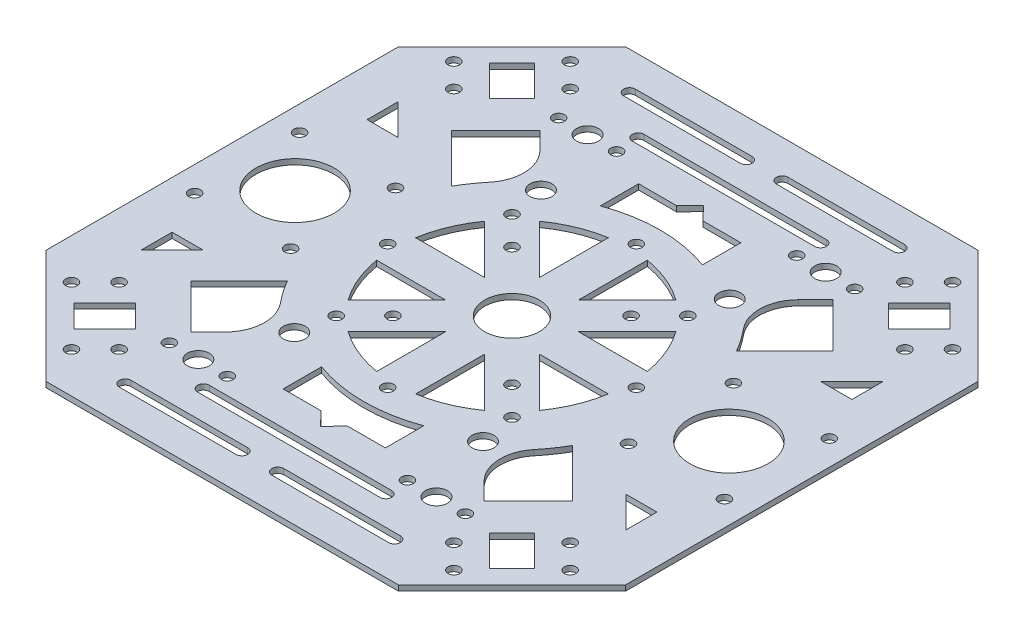
from build123d import *

# Parameters (mm, degrees)
BOSS_EXTRUDE1_DEPTH = 0.7
SKETCH3_R           = 1.5
CUT_EXTRUDE1_DEPTH  = 105.661167584
SKETCH9_R           = 1.5
SKETCH9_R_2         = 2.8
CUT_EXTRUDE5_DEPTH  = 105.661167584
SKETCH10_R          = 10
SKETCH10_R_2        = 1.5
CUT_EXTRUDE6_DEPTH  = 105.661167584
SKETCH11_R          = 7
SKETCH11_R_2        = 1.5
CUT_EXTRUDE7_DEPTH  = 105.661167584


with BuildPart() as part:
    # Sketch1 → Boss-Extrude1 (new, symmetric)
    with BuildSketch(Plane(origin=(0, 0, 0), x_dir=(1, 0, 0), z_dir=(0, 1, 0))):
        Polygon((-74, 45), (-45, 74), (45, 74), (74, 45), (74, -45), (45, -74), (-45, -74), (-74, -45), align=None)
    extrude(amount=BOSS_EXTRUDE1_DEPTH, both=True)

    # Sketch3 → Cut-Extrude1 (cut, through all)
    with BuildSketch(Plane(origin=(0, 0.7, 0), x_dir=(1, 0, 0), z_dir=(0, 1, 0))):
        with Locations(Location((-48.822687604, 63.671930009, 0), (0, 0, 270))):
            Circle(SKETCH3_R)
        with Locations(Location((-63.671930009, 48.822687604, 0), (0, 0, 270))):
            Circle(SKETCH3_R)
        with Locations(Location((-57.590811691, 42.741569286, 0), (0, 0, 270))):
            Circle(SKETCH3_R)
        with Locations(Location((-42.741569286, 57.590811691, 0), (0, 0, 270))):
            Circle(SKETCH3_R)
        with Locations(Location((63.671930009, 48.822687604, 0), (0, 0, 270))):
            Circle(SKETCH3_R)
        with Locations(Location((48.822687604, 63.671930009, 0), (0, 0, 270))):
            Circle(SKETCH3_R)
        with Locations(Location((42.741569286, 57.590811691, 0), (0, 0, 270))):
            Circle(SKETCH3_R)
        with Locations(Location((57.590811691, 42.741569286, 0), (0, 0, 270))):
            Circle(SKETCH3_R)
        with Locations(Location((48.822687604, -63.671930009, 0), (0, 0, 270))):
            Circle(SKETCH3_R)
        with Locations(Location((63.671930009, -48.822687604, 0), (0, 0, 270))):
            Circle(SKETCH3_R)
        with Locations(Location((57.590811691, -42.741569286, 0), (0, 0, 270))):
            Circle(SKETCH3_R)
        with Locations(Location((42.741569286, -57.590811691, 0), (0, 0, 270))):
            Circle(SKETCH3_R)
        with Locations(Location((-63.671930009, -48.822687604, 0), (0, 0, 270))):
            Circle(SKETCH3_R)
        with Locations(Location((-48.822687604, -63.671930009, 0), (0, 0, 270))):
            Circle(SKETCH3_R)
        with Locations(Location((-42.741569286, -57.590811691, 0), (0, 0, 270))):
            Circle(SKETCH3_R)
        with Locations(Location((-57.590811691, -42.741569286, 0), (0, 0, 270))):
            Circle(SKETCH3_R)
        Polygon((-50.908652609, 45.181087681), (-58.75753788, 53.029972952), (-53.029972952, 58.75753788), (-45.181087681, 50.908652609), align=None)
        Polygon((45.181087681, 50.908652609), (53.029972952, 58.75753788), (58.75753788, 53.029972952), (50.908652609, 45.181087681), align=None)
        Polygon((50.908652609, -45.181087681), (58.75753788, -53.029972952), (53.029972952, -58.75753788), (45.181087681, -50.908652609), align=None)
        Polygon((-45.181087681, -50.908652609), (-53.029972952, -58.75753788), (-58.75753788, -53.029972952), (-50.908652609, -45.181087681), align=None)
    extrude(amount=-CUT_EXTRUDE1_DEPTH, mode=Mode.SUBTRACT)

    # Sketch9 → Cut-Extrude5 (cut, through all)
    with BuildSketch(Plane(origin=(0, 0.7, 0), x_dir=(1, 0, 0), z_dir=(0, 1, 0))):
        with Locations(Location((-37.8, 49.7, 0), (0, 0, 270))):
            Circle(SKETCH9_R)
        with Locations(Location((-30.4, 49.7, 0), (0, 0, 270))):
            Circle(SKETCH9_R_2)
        with Locations(Location((-23, 49.7, 0), (0, 0, 270))):
            Circle(SKETCH9_R)
        with Locations(Location((23, 49.7, 0), (0, 0, 270))):
            Circle(SKETCH9_R)
        with Locations(Location((30.4, 49.7, 0), (0, 0, 270))):
            Circle(SKETCH9_R_2)
        with Locations(Location((37.8, 49.7, 0), (0, 0, 270))):
            Circle(SKETCH9_R)
        with Locations(Location((-24.1, 31.5, 0), (0, 0, 270))):
            Circle(SKETCH9_R_2)
        with Locations(Location((24.1, 31.5, 0), (0, 0, 270))):
            Circle(SKETCH9_R_2)
        with Locations(Location((24.1, -31.5, 0), (0, 0, 90))):
            Circle(SKETCH9_R_2)
        with Locations(Location((-24.1, -31.5, 0), (0, 0, 90))):
            Circle(SKETCH9_R_2)
        with Locations(Location((37.8, -49.7, 0), (0, 0, 90))):
            Circle(SKETCH9_R)
        with Locations(Location((30.4, -49.7, 0), (0, 0, 90))):
            Circle(SKETCH9_R_2)
        with Locations(Location((23, -49.7, 0), (0, 0, 90))):
            Circle(SKETCH9_R)
        with Locations(Location((-23, -49.7, 0), (0, 0, 90))):
            Circle(SKETCH9_R)
        with Locations(Location((-30.4, -49.7, 0), (0, 0, 90))):
            Circle(SKETCH9_R_2)
        with Locations(Location((-37.8, -49.7, 0), (0, 0, 90))):
            Circle(SKETCH9_R)
        with BuildLine():
            Line((-34.4, 65.9), (-4.6, 65.9))
            ThreePointArc((-4.6, 65.9), (-3.1, 64.4), (-4.6, 62.9))
            Line((-4.6, 62.9), (-34.4, 62.9))
            ThreePointArc((-34.4, 62.9), (-35.9, 64.4), (-34.4, 65.9))
        make_face()
        with BuildLine():
            Line((4.6, 65.9), (34.4, 65.9))
            ThreePointArc((34.4, 65.9), (35.9, 64.4), (34.4, 62.9))
            Line((34.4, 62.9), (4.6, 62.9))
            ThreePointArc((4.6, 62.9), (3.1, 64.4), (4.6, 65.9))
        make_face()
        with BuildLine():
            Line((-23.3, 57), (23.3, 57))
            ThreePointArc((23.3, 57), (24.8, 55.5), (23.3, 54))
            Line((23.3, 54), (-23.3, 54))
            ThreePointArc((-23.3, 54), (-24.8, 55.5), (-23.3, 57))
        make_face()
        with BuildLine():
            Line((-3.4, 45.382404359), (0, 48.882404359))
            Line((0, 48.882404359), (3.4, 45.382404359))
            Line((3.4, 45.382404359), (13.05, 45.382404359))
            Line((13.05, 45.382404359), (13.05, 35.582404359))
            ThreePointArc((13.05, 35.582404359), (0, 37.9), (-13.05, 35.582404359))
            Line((-13.05, 35.582404359), (-13.05, 45.382404359))
            Line((-13.05, 45.382404359), (-3.4, 45.382404359))
        make_face()
        with BuildLine():
            Line((-34.4, -65.9), (-4.6, -65.9))
            ThreePointArc((-4.6, -65.9), (-3.1, -64.4), (-4.6, -62.9))
            Line((-4.6, -62.9), (-34.4, -62.9))
            ThreePointArc((-34.4, -62.9), (-35.9, -64.4), (-34.4, -65.9))
        make_face()
        with BuildLine():
            Line((4.6, -65.9), (34.4, -65.9))
            ThreePointArc((34.4, -65.9), (35.9, -64.4), (34.4, -62.9))
            Line((34.4, -62.9), (4.6, -62.9))
            ThreePointArc((4.6, -62.9), (3.1, -64.4), (4.6, -65.9))
        make_face()
        with BuildLine():
            Line((-23.3, -57), (23.3, -57))
            ThreePointArc((23.3, -57), (24.8, -55.5), (23.3, -54))
            Line((23.3, -54), (-23.3, -54))
            ThreePointArc((-23.3, -54), (-24.8, -55.5), (-23.3, -57))
        make_face()
        with BuildLine():
            Line((3.4, -45.382404359), (13.05, -45.382404359))
            Line((13.05, -45.382404359), (13.05, -35.582404359))
            ThreePointArc((13.05, -35.582404359), (0, -37.9), (-13.05, -35.582404359))
            Line((-13.05, -35.582404359), (-13.05, -45.382404359))
            Line((-13.05, -45.382404359), (-3.4, -45.382404359))
            Line((-3.4, -45.382404359), (0, -48.882404359))
            Line((0, -48.882404359), (3.4, -45.382404359))
        make_face()
    extrude(amount=-CUT_EXTRUDE5_DEPTH, mode=Mode.SUBTRACT)

    # Sketch10 → Cut-Extrude6 (cut, through all)
    with BuildSketch(Plane(origin=(0, 0.7, 0), x_dir=(1, 0, 0), z_dir=(0, 1, 0))):
        with Locations(Location((-55.4, 0, 0), (0, 0, 270))):
            Circle(SKETCH10_R)
        with Locations(Location((-67.65, 13.4, 0), (0, 0, 270))):
            Circle(SKETCH10_R_2)
        with Locations(Location((-43.15, 13.4, 0), (0, 0, 270))):
            Circle(SKETCH10_R_2)
        with Locations(Location((-43.15, -13.4, 0), (0, 0, 270))):
            Circle(SKETCH10_R_2)
        with Locations(Location((-67.65, -13.4, 0), (0, 0, 270))):
            Circle(SKETCH10_R_2)
        with Locations(Location((67.65, -13.4, 0), (0, 0, 90))):
            Circle(SKETCH10_R_2)
        with Locations(Location((43.15, -13.4, 0), (0, 0, 90))):
            Circle(SKETCH10_R_2)
        with Locations(Location((43.15, 13.4, 0), (0, 0, 90))):
            Circle(SKETCH10_R_2)
        with Locations(Location((67.65, 13.4, 0), (0, 0, 90))):
            Circle(SKETCH10_R_2)
        with Locations(Location((55.4, 0, 0), (0, 0, 90))):
            Circle(SKETCH10_R)
        Polygon((-61.9, 32.8), (-61.9, 24.9), (-54, 24.9), align=None)
        Polygon((-61.9, -24.9), (-61.9, -32.8), (-54, -24.9), align=None)
        with BuildLine():
            Line((-48.716621587, 33.230983079), (-36.414211791, 20.928573283))
            ThreePointArc((-36.414211791, 20.928573283), (-34.52479878, 23.917321531), (-32.390688369, 26.736553761))
            ThreePointArc((-32.390688369, 26.736553761), (-30.114116226, 33.578902702), (-33.031689216, 40.173467706))
            Line((-33.031689216, 40.173467706), (-37.402913088, 44.544691578))
            Line((-37.402913088, 44.544691578), (-48.716621587, 33.230983079))
        make_face()
        with BuildLine():
            Line((-37.402913088, -44.544691578), (-33.031689216, -40.173467706))
            ThreePointArc((-33.031689216, -40.173467706), (-30.114116226, -33.578902702), (-32.390688369, -26.736553761))
            ThreePointArc((-32.390688369, -26.736553761), (-34.52479878, -23.917321531), (-36.414211791, -20.928573283))
            Line((-36.414211791, -20.928573283), (-48.716621587, -33.230983079))
            Line((-48.716621587, -33.230983079), (-37.402913088, -44.544691578))
        make_face()
        with BuildLine():
            Line((48.716621587, -33.230983079), (36.414211791, -20.928573283))
            ThreePointArc((36.414211791, -20.928573283), (34.52479878, -23.917321531), (32.390688369, -26.736553761))
            ThreePointArc((32.390688369, -26.736553761), (30.114116226, -33.578902702), (33.031689216, -40.173467706))
            Line((33.031689216, -40.173467706), (37.402913088, -44.544691578))
            Line((37.402913088, -44.544691578), (48.716621587, -33.230983079))
        make_face()
        with BuildLine():
            Line((37.402913088, 44.544691578), (33.031689216, 40.173467706))
            ThreePointArc((33.031689216, 40.173467706), (30.114116226, 33.578902702), (32.390688369, 26.736553761))
            ThreePointArc((32.390688369, 26.736553761), (34.52479878, 23.917321531), (36.414211791, 20.928573283))
            Line((36.414211791, 20.928573283), (48.716621587, 33.230983079))
            Line((48.716621587, 33.230983079), (37.402913088, 44.544691578))
        make_face()
        Polygon((54, -24.9), (61.9, -24.9), (61.9, -32.8), align=None)
        Polygon((54, 24.9), (61.9, 32.8), (61.9, 24.9), align=None)
    extrude(amount=-CUT_EXTRUDE6_DEPTH, mode=Mode.SUBTRACT)

    # Sketch11 → Cut-Extrude7 (cut, through all)
    with BuildSketch(Plane(origin=(0, 0.7, 0), x_dir=(1, 0, 0), z_dir=(0, 1, 0))):
        with Locations(Location((0, 0, 0), (0, 0, 270))):
            Circle(SKETCH11_R)
        with Locations(Location((15.202795796, 15.202795796, 0), (0, 0, 270))):
            Circle(SKETCH11_R_2)
        with Locations(Location((0, 31.75, 0), (0, 0, 270))):
            Circle(SKETCH11_R_2)
        with Locations(Location((22.450640303, 22.450640303, 0), (0, 0, 270))):
            Circle(SKETCH11_R_2)
        with Locations(Location((31.75, 0, 0), (0, 0, 270))):
            Circle(SKETCH11_R_2)
        with Locations(Location((22.450640303, -22.450640303, 0), (0, 0, 270))):
            Circle(SKETCH11_R_2)
        with Locations(Location((0, -31.75, 0), (0, 0, 270))):
            Circle(SKETCH11_R_2)
        with Locations(Location((-22.450640303, -22.450640303, 0), (0, 0, 270))):
            Circle(SKETCH11_R_2)
        with Locations(Location((-31.75, 0, 0), (0, 0, 270))):
            Circle(SKETCH11_R_2)
        with Locations(Location((-22.450640303, 22.450640303, 0), (0, 0, 270))):
            Circle(SKETCH11_R_2)
        with Locations(Location((15.202795796, -15.202795796, 0), (0, 0, 270))):
            Circle(SKETCH11_R_2)
        with Locations(Location((-15.202795796, -15.202795796, 0), (0, 0, 270))):
            Circle(SKETCH11_R_2)
        with Locations(Location((-15.202795796, 15.202795796, 0), (0, 0, 270))):
            Circle(SKETCH11_R_2)
        with BuildLine():
            Line((-17.401720121, 24.437269423), (-4.974884621, 12.010433923))
            Line((-4.974884621, 12.010433923), (-4.974884621, 29.584633224))
            ThreePointArc((-4.974884621, 29.584633224), (-11.480502971, 27.716385975), (-17.401720121, 24.437269423))
        make_face()
        with BuildLine():
            Line((4.974884621, 29.584633224), (4.974884621, 12.010433923))
            Line((4.974884621, 12.010433923), (17.401720121, 24.437269423))
            ThreePointArc((17.401720121, 24.437269423), (11.480502971, 27.716385975), (4.974884621, 29.584633224))
        make_face()
        with BuildLine():
            Line((24.437269423, 17.401720121), (12.010433923, 4.974884621))
            Line((12.010433923, 4.974884621), (29.584633224, 4.974884621))
            ThreePointArc((29.584633224, 4.974884621), (27.716385975, 11.480502971), (24.437269423, 17.401720121))
        make_face()
        with BuildLine():
            Line((29.584633224, -4.974884621), (12.010433923, -4.974884621))
            Line((12.010433923, -4.974884621), (24.437269423, -17.401720121))
            ThreePointArc((24.437269423, -17.401720121), (27.716385975, -11.480502971), (29.584633224, -4.974884621))
        make_face()
        with BuildLine():
            Line((17.401720121, -24.437269423), (4.974884621, -12.010433923))
            Line((4.974884621, -12.010433923), (4.974884621, -29.584633224))
            ThreePointArc((4.974884621, -29.584633224), (11.480502971, -27.716385975), (17.401720121, -24.437269423))
        make_face()
        with BuildLine():
            Line((-4.974884621, -29.584633224), (-4.974884621, -12.010433923))
            Line((-4.974884621, -12.010433923), (-17.401720121, -24.437269423))
            ThreePointArc((-17.401720121, -24.437269423), (-11.480502971, -27.716385975), (-4.974884621, -29.584633224))
        make_face()
        with BuildLine():
            Line((-24.437269423, -17.401720121), (-12.010433923, -4.974884621))
            Line((-12.010433923, -4.974884621), (-29.584633224, -4.974884621))
            ThreePointArc((-29.584633224, -4.974884621), (-27.716385975, -11.480502971), (-24.437269423, -17.401720121))
        make_face()
        with BuildLine():
            Line((-29.584633224, 4.974884621), (-12.010433923, 4.974884621))
            Line((-12.010433923, 4.974884621), (-24.437269423, 17.401720121))
            ThreePointArc((-24.437269423, 17.401720121), (-27.716385975, 11.480502971), (-29.584633224, 4.974884621))
        make_face()
    extrude(amount=-CUT_EXTRUDE7_DEPTH, mode=Mode.SUBTRACT)


solid = part.part
